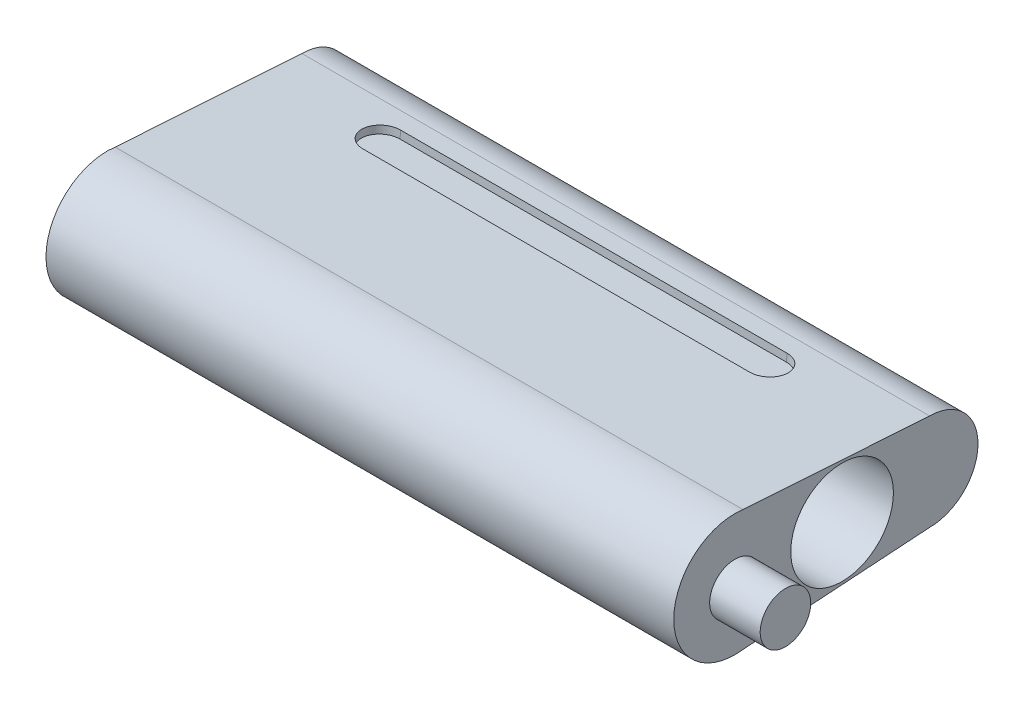
from build123d import *

# Parameters (mm, degrees)
BOSS_EXTRUDE1_DEPTH = 12.419249514
SKETCH3_R           = 1.015618984
CUT_EXTRUDE1_DEPTH  = 13.419249514
SKETCH4_R           = 0.5
BOSS_EXTRUDE4_DEPTH = 1
CUT_EXTRUDE4_DEPTH  = 0.15


with BuildPart() as part:
    # Sketch2 → Boss-Extrude1 (new body)
    with BuildSketch(Plane(origin=(0, 0, 0), x_dir=(0, 0, -1), z_dir=(1, 0, 0))):
        with BuildLine():
            Line((0.159499861, 1.199062904), (3.854352819, 0.954395011))
            ThreePointArc((3.854352819, 0.954395011), (4.80874783, 0), (3.854352819, -0.954395011))
            Line((3.854352819, -0.954395011), (0.159499861, -1.199062904))
            ThreePointArc((0.159499861, -1.199062904), (-1.209624757, 0), (0.159499861, 1.199062904))
        make_face()
    extrude(amount=BOSS_EXTRUDE1_DEPTH)

    # Sketch3 → Cut-Extrude1 (cut)
    with BuildSketch(Plane(origin=(12.419249514, 0, 0), x_dir=(0, 0, -1), z_dir=(1, 0, 0))):
        with Locations((2.120083087, 0)):
            Circle(SKETCH3_R)
    extrude(amount=-CUT_EXTRUDE1_DEPTH, mode=Mode.SUBTRACT)

    # Sketch4 → Boss-Extrude4 (add)
    with BuildSketch(Plane(origin=(12.419249514, -0.073237878, 0), x_dir=(0, 0, -1), z_dir=(1, 0, 0))):
        Circle(SKETCH4_R)
    extrude(amount=BOSS_EXTRUDE4_DEPTH)

    # Sketch7 → Cut-Extrude4 (cut)
    with BuildSketch(Plane(origin=(0, 1.20434383, -0.079749931), x_dir=(1, 0, 0), z_dir=(0, 0.9978147342638661, -0.06607386840446525))):
        with BuildLine():
            Line((2.310540733, 3.421811002), (9.955936015, 3.421811002))
            ThreePointArc((9.955936015, 3.421811002), (10.328984883, 3.048762133), (9.955936015, 2.675713265))
            Line((9.955936015, 2.675713265), (2.310540733, 2.675713265))
            ThreePointArc((2.310540733, 2.675713265), (1.937491864, 3.048762133), (2.310540733, 3.421811002))
        make_face()
    extrude(amount=-CUT_EXTRUDE4_DEPTH, mode=Mode.SUBTRACT)


solid = part.part
